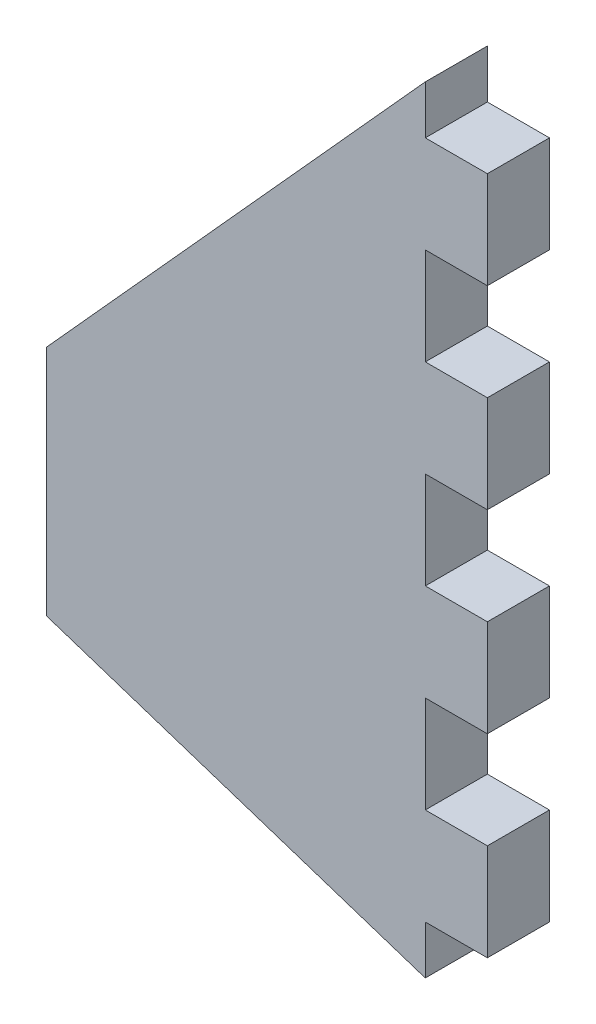
from build123d import *

# Parameters (mm, degrees)
ESTRUSIONE_ESTRUSIONE1_DEPTH = 4
SCHIZZO2_W                   = 4
SCHIZZO2_H                   = 6.25
ESTRUSIONE_ESTRUSIONE2_DEPTH = 4
RIPETIZIONE_A_L1_COUNT       = 4
RIPETIZIONE_A_L1_PITCH       = 12.5


with BuildPart() as part:
    # Schizzo1 → Estrusione-Estrusione1 (new body)
    with BuildSketch(Plane.XY):
        Polygon((-24.4, 23), (-24.4, 8), (0, 0), (0, 50), align=None)
    extrude(amount=ESTRUSIONE_ESTRUSIONE1_DEPTH)

    # Schizzo2 → Estrusione-Estrusione2 (add)
    with BuildSketch(Plane.XY.offset(4)):
        with Locations((2, 43.75)):
            Rectangle(SCHIZZO2_W, SCHIZZO2_H)
    estrusione_estrusione2 = extrude(amount=-ESTRUSIONE_ESTRUSIONE2_DEPTH)

    # Ripetizione a L1: Estrusione-Estrusione2 ×4
    with Locations(*[(0, -i * RIPETIZIONE_A_L1_PITCH, 0) for i in range(1, RIPETIZIONE_A_L1_COUNT)]):
        add(estrusione_estrusione2)


solid = part.part
